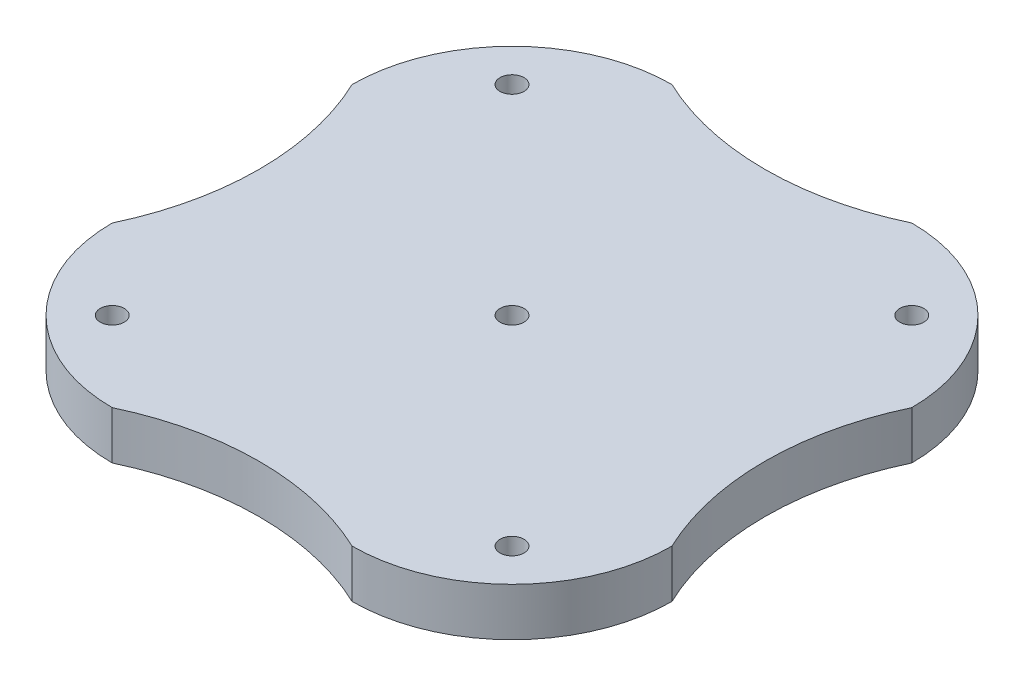
from build123d import *

# Parameters (mm, degrees)
EXTRUDE_1_DEPTH     = 6
SKETCH_2_R          = 1.5
CUT_EXTRUDE_1_DEPTH = 6
CUT_EXTRUDE_2_DEPTH = 2
SKETCH_4_R          = 35
CUT_EXTRUDE_3_DEPTH = 50.859803449


with BuildPart() as part:
    # Эскиз1 → Бобышка-Вытянуть1 (new body)
    with BuildSketch(Plane(origin=(0, 0, 0), x_dir=(1, 0, 0), z_dir=(0, 1, 0))):
        with BuildLine():
            Line((15, -35), (-15, -35))
            ThreePointArc((-15, -35), (-29.142135624, -29.142135624), (-35, -15))
            Line((-35, -15), (-35, 15))
            ThreePointArc((-35, 15), (-29.142135624, 29.142135624), (-15, 35))
            Line((-15, 35), (15, 35))
            ThreePointArc((15, 35), (29.142135624, 29.142135624), (35, 15))
            Line((35, 15), (35, -15))
            ThreePointArc((35, -15), (29.142135624, -29.142135624), (15, -35))
        make_face()
    extrude(amount=EXTRUDE_1_DEPTH)

    # Эскиз2 → Вырез-Вытянуть1 (cut)
    with BuildSketch(Plane(origin=(0, 0, 0), x_dir=(1, 0, 0), z_dir=(0, 1, 0))):
        with Locations(Location((-25, 25, 0), (0, 0, 270))):
            Circle(SKETCH_2_R)
        with Locations(Location((25, 25, 0), (0, 0, 270))):
            Circle(SKETCH_2_R)
        with Locations(Location((25, -25, 0), (0, 0, 270))):
            Circle(SKETCH_2_R)
        with Locations(Location((-25, -25, 0), (0, 0, 270))):
            Circle(SKETCH_2_R)
        with Locations(Location((0, 0, 0), (0, 0, 270))):
            Circle(SKETCH_2_R)
    extrude(amount=CUT_EXTRUDE_1_DEPTH, mode=Mode.SUBTRACT)

    # Эскиз3 → Вырез-Вытянуть2 (cut)
    with BuildSketch(Plane(origin=(0, 0, 0), x_dir=(1, 0, 0), z_dir=(0, 1, 0))):
        Polygon((-26.732050808, 28), (-28.464101615, 25), (-26.732050808, 22), (-23.267949192, 22), (-21.535898385, 25), (-23.267949192, 28), align=None)
        Polygon((23.267949192, 28), (21.535898385, 25), (23.267949192, 22), (26.732050808, 22), (28.464101615, 25), (26.732050808, 28), align=None)
        Polygon((23.267949192, -22), (21.535898385, -25), (23.267949192, -28), (26.732050808, -28), (28.464101615, -25), (26.732050808, -22), align=None)
        Polygon((-26.732050808, -22), (-28.464101615, -25), (-26.732050808, -28), (-23.267949192, -28), (-21.535898385, -25), (-23.267949192, -22), align=None)
        Polygon((-1.732050808, 3), (-3.464101615, 0), (-1.732050808, -3), (1.732050808, -3), (3.464101615, 0), (1.732050808, 3), align=None)
    extrude(amount=CUT_EXTRUDE_2_DEPTH, mode=Mode.SUBTRACT)

    # Эскиз4 → Вырез-Вытянуть3 (cut, through all)
    with BuildSketch(Plane(origin=(0, 0, 0), x_dir=(1, 0, 0), z_dir=(0, 1, 0))):
        with Locations((-66.622776602, 0)):
            Circle(SKETCH_4_R)
        with Locations((0, 66.622776602)):
            Circle(SKETCH_4_R)
        with Locations((66.622776602, 0)):
            Circle(SKETCH_4_R)
        with Locations((0, -66.622776602)):
            Circle(SKETCH_4_R)
    extrude(amount=CUT_EXTRUDE_3_DEPTH, mode=Mode.SUBTRACT)


solid = part.part
